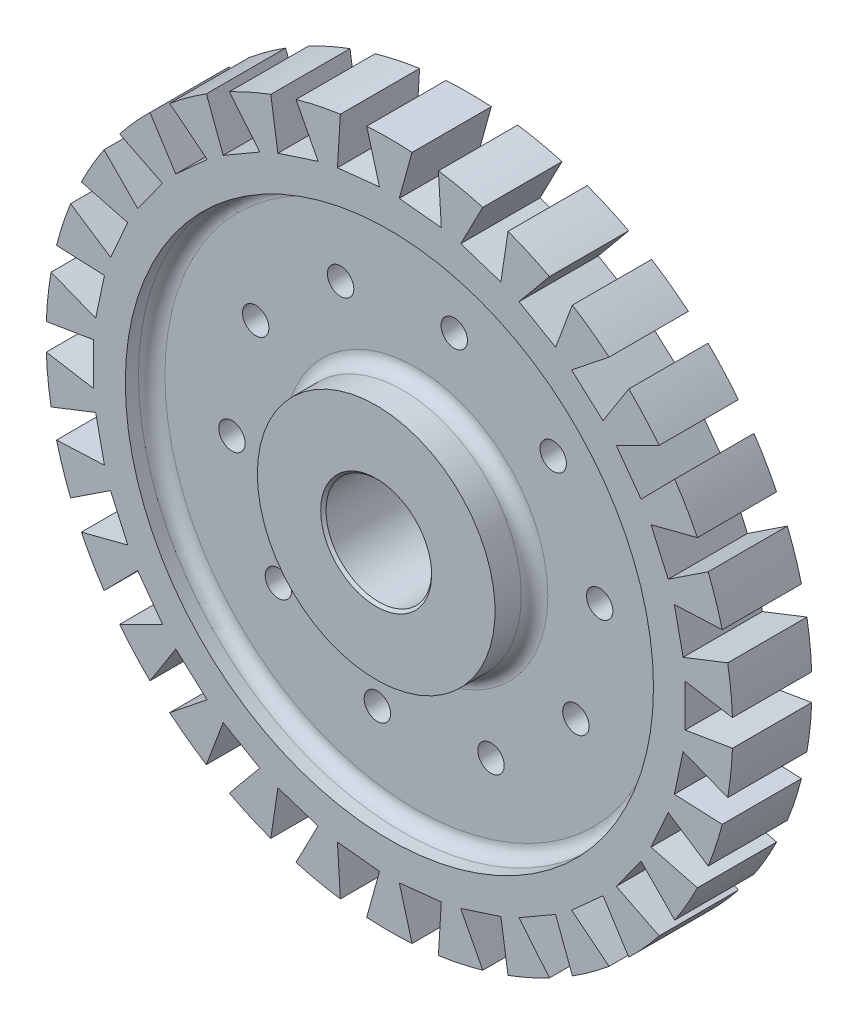
from build123d import *

# Parameters (mm, degrees)
FILLET_1_R               = 5
CHAMFER_1_SIZE           = 1
CUT_EXTRUDE_2_DEPTH      = 189.148877222
PATTERN_CIRCULAR_1_COUNT = 30
SKETCH_4_R               = 5
CUT_EXTRUDE_3_DEPTH      = 189.081998408


with BuildPart() as part:
    # 草图1 → 旋转1 (revolve)
    with BuildSketch(Plane(origin=(0, 0, 0), x_dir=(1, 0, 0), z_dir=(0, 1, 0))):
        Polygon((20, 0), (45, 0), (45, -15), (100, -15), (100, -5), (130, -5), (130, -35), (100, -35), (100, -25), (45, -25), (45, -40), (20, -40), align=None)
    revolve(axis=Axis((0, 0, 0), (0, 0, 1)))

    # 圆角1
    fillet_1_edges = [part.edges().sort_by_distance(p)[0] for p in [
        (-100, 0, 15),
        (-100, 0, 25),
        (-45, 0, 25),
        (-45, 0, 15),
    ]]
    fillet(fillet_1_edges, radius=FILLET_1_R)

    # 倒角1
    chamfer_1_edges = [part.edges().sort_by_distance(p)[0] for p in [
        (-20, 0, 0),
        (-20, 0, 40),
    ]]
    chamfer(chamfer_1_edges, length=CHAMFER_1_SIZE)

    # 草图3 → 切除-拉伸2 (cut, through all)
    with BuildSketch(Plane.XY.offset(40)):
        Polygon((112, 8), (135, 4.1667), (135, -4.1667), (112, -8), align=None)
    cut_extrude_2 = extrude(amount=-CUT_EXTRUDE_2_DEPTH, mode=Mode.SUBTRACT)

    # 阵列(圆周)1: 切除-拉伸2 ×30 about axis
    pattern_circular_1_axis = Axis((0, 0, 42), (0, 0, -1))
    for i in range(1, PATTERN_CIRCULAR_1_COUNT):
        add(cut_extrude_2.rotate(pattern_circular_1_axis, i * 360 / PATTERN_CIRCULAR_1_COUNT), mode=Mode.SUBTRACT)

    # 草图4 → 切除-拉伸3 (cut, through all)
    with BuildSketch(Plane.XY.offset(40)):
        with Locations((69.616533, 7.316992)):
            Circle(SKETCH_4_R)
        with Locations((52.020138, 46.839142)):
            Circle(SKETCH_4_R)
        with Locations((14.553818, 68.470332)):
            Circle(SKETCH_4_R)
        with Locations((-28.471565, 63.948182)):
            Circle(SKETCH_4_R)
        with Locations((-60.621778, 35)):
            Circle(SKETCH_4_R)
        with Locations((-69.616533, -7.316992)):
            Circle(SKETCH_4_R)
        with Locations((-52.020138, -46.839142)):
            Circle(SKETCH_4_R)
        with Locations((-14.553818, -68.470332)):
            Circle(SKETCH_4_R)
        with Locations((28.471565, -63.948182)):
            Circle(SKETCH_4_R)
        with Locations((60.621778, -35)):
            Circle(SKETCH_4_R)
    extrude(amount=-CUT_EXTRUDE_3_DEPTH, mode=Mode.SUBTRACT)


solid = part.part
